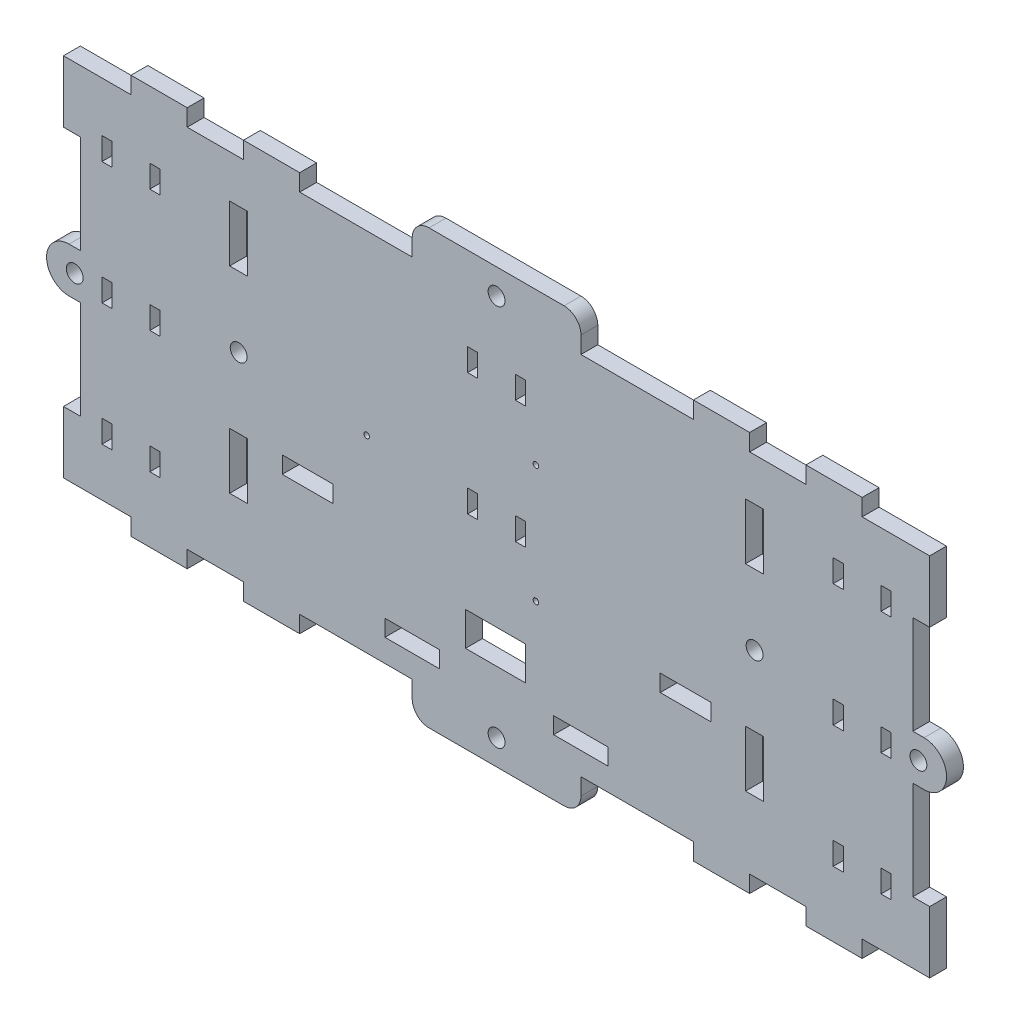
from build123d import *

# Parameters (mm, degrees)
CROQUIS2_R              = 0.5
CROQUIS2_R_2            = 1.5
CROQUIS2_W              = 1.8
CROQUIS2_H              = 4
CROQUIS2_W_2            = 9
CROQUIS2_H_2            = 3
CROQUIS2_W_3            = 9.7
CROQUIS2_H_3            = 2.94
CROQUIS2_W_4            = 10.628979849
CROQUIS2_H_4            = 6
SALIENTE_EXTRUIR1_DEPTH = 3


with BuildPart() as part:
    # Croquis2 → Saliente-Extruir1 (new body)
    with BuildSketch(Plane.XY):
        with BuildLine():
            Line((33708.140369107, 12866.76836421), (33708.140369107, 12884.268432106))
            Line((33708.140369107, 12884.268432106), (33710.140369103, 12884.268296333))
            ThreePointArc((33710.140369103, 12884.268296333), (33714.140640639, 12888.268024778), (33710.140912194, 12892.268296314))
            Line((33710.140912194, 12892.268296314), (33708.14091219, 12892.268296314))
            Line((33708.14091219, 12892.268296314), (33708.140369107, 12909.76836421))
            Line((33708.140369107, 12909.76836421), (33711.140369107, 12909.76836421))
            Line((33711.140369107, 12909.76836421), (33711.140369107, 12920.76836421))
            Line((33711.140369107, 12920.76836421), (33699.140369107, 12920.76836421))
            Line((33699.140369107, 12920.76836421), (33699.140369107, 12923.76836421))
            Line((33699.140369107, 12923.76836421), (33689.140369107, 12923.76836421))
            Line((33689.140369107, 12923.76836421), (33689.140369107, 12920.76836421))
            Line((33689.140369107, 12920.76836421), (33679.140369107, 12920.76836421))
            Line((33679.140369107, 12920.76836421), (33679.140369107, 12923.76836421))
            Line((33679.140369107, 12923.76836421), (33669.140369107, 12923.76836421))
            Line((33669.140369107, 12923.76836421), (33669.140369107, 12920.76836421))
            Line((33669.140369107, 12920.76836421), (33649.140369107, 12920.76836421))
            Line((33649.140369107, 12920.76836421), (33649.140369107, 12923.76836421))
            ThreePointArc((33649.140369107, 12923.76836421), (33648.261689451, 12925.889684554), (33646.140369107, 12926.76836421))
            Line((33646.140369107, 12926.76836421), (33622.140369107, 12926.76836421))
            ThreePointArc((33622.140369107, 12926.76836421), (33620.019048764, 12925.889684554), (33619.140369107, 12923.76836421))
            Line((33619.140369107, 12923.76836421), (33619.140369107, 12920.76836421))
            Line((33619.140369107, 12920.76836421), (33599.140369107, 12920.76836421))
            Line((33599.140369107, 12920.76836421), (33599.140369107, 12923.76836421))
            Line((33599.140369107, 12923.76836421), (33589.140369107, 12923.76836421))
            Line((33589.140369107, 12923.76836421), (33589.140369107, 12920.76836421))
            Line((33589.140369107, 12920.76836421), (33579.140369107, 12920.76836421))
            Line((33579.140369107, 12920.76836421), (33579.140369107, 12923.76836421))
            Line((33579.140369107, 12923.76836421), (33569.140369107, 12923.76836421))
            Line((33569.140369107, 12923.76836421), (33569.140369107, 12920.76836421))
            Line((33569.140369107, 12920.76836421), (33557.140369107, 12920.76836421))
            Line((33557.140369107, 12920.76836421), (33557.140369107, 12909.76836421))
            Line((33557.140369107, 12909.76836421), (33560.140369107, 12909.76836421))
            Line((33560.140369107, 12909.76836421), (33560.139826016, 12892.268432087))
            Line((33560.139826016, 12892.268432087), (33558.13982602, 12892.268296314))
            ThreePointArc((33558.13982602, 12892.268296314), (33554.140097575, 12888.268024778), (33558.140369112, 12884.268296333))
            Line((33558.140369112, 12884.268296333), (33560.140369107, 12884.268432106))
            Line((33560.140369107, 12884.268432106), (33560.140369107, 12866.76836421))
            Line((33560.140369107, 12866.76836421), (33559.115527824, 12866.76836421))
            Line((33559.115527824, 12866.76836421), (33558.815527824, 12866.76836421))
            Line((33558.815527824, 12866.76836421), (33557.140369107, 12866.76836421))
            Line((33557.140369107, 12866.76836421), (33557.140369107, 12861.352876793))
            Line((33557.140369107, 12861.352876793), (33557.140369107, 12861.058331403))
            Line((33557.140369107, 12861.058331403), (33557.140369107, 12855.76836421))
            Line((33557.140369107, 12855.76836421), (33569.140369107, 12855.76836421))
            Line((33569.140369107, 12855.76836421), (33569.140369107, 12852.76836421))
            Line((33569.140369107, 12852.76836421), (33579.140369107, 12852.76836421))
            Line((33579.140369107, 12852.76836421), (33579.140369107, 12855.76836421))
            Line((33579.140369107, 12855.76836421), (33589.140369107, 12855.76836421))
            Line((33589.140369107, 12855.76836421), (33589.140369107, 12852.76836421))
            Line((33589.140369107, 12852.76836421), (33599.140369107, 12852.76836421))
            Line((33599.140369107, 12852.76836421), (33599.140369107, 12855.76836421))
            Line((33599.140369107, 12855.76836421), (33609.140369107, 12855.76836421))
            Line((33609.140369107, 12855.76836421), (33619.140369107, 12855.76836421))
            Line((33619.140369107, 12855.76836421), (33619.140369107, 12852.76836421))
            ThreePointArc((33619.140369107, 12852.76836421), (33620.019048764, 12850.647043866), (33622.140369107, 12849.76836421))
            Line((33622.140369107, 12849.76836421), (33646.140369107, 12849.76836421))
            ThreePointArc((33646.140369107, 12849.76836421), (33648.261689451, 12850.647043866), (33649.140369107, 12852.76836421))
            Line((33649.140369107, 12852.76836421), (33649.140369107, 12855.76836421))
            Line((33649.140369107, 12855.76836421), (33659.140369107, 12855.76836421))
            Line((33659.140369107, 12855.76836421), (33665.009331237, 12855.76836421))
            Line((33665.009331237, 12855.76836421), (33665.309331237, 12855.76836421))
            Line((33665.309331237, 12855.76836421), (33669.140369107, 12855.76836421))
            Line((33669.140369107, 12855.76836421), (33669.140369107, 12852.76836421))
            Line((33669.140369107, 12852.76836421), (33679.140369107, 12852.76836421))
            Line((33679.140369107, 12852.76836421), (33679.140369107, 12855.76836421))
            Line((33679.140369107, 12855.76836421), (33685.009331237, 12855.76836421))
            Line((33685.009331237, 12855.76836421), (33685.309331237, 12855.76836421))
            Line((33685.309331237, 12855.76836421), (33689.140369107, 12855.76836421))
            Line((33689.140369107, 12855.76836421), (33689.140369107, 12852.76836421))
            Line((33689.140369107, 12852.76836421), (33699.140369107, 12852.76836421))
            Line((33699.140369107, 12852.76836421), (33699.140369107, 12855.76836421))
            Line((33699.140369107, 12855.76836421), (33711.140369107, 12855.76836421))
            Line((33711.140369107, 12855.76836421), (33711.140369107, 12866.76836421))
            Line((33711.140369107, 12866.76836421), (33708.140369107, 12866.76836421))
        make_face()
        with Locations((33641.140369107, 12899.76836421)):
            Circle(CROQUIS2_R, mode=Mode.SUBTRACT)
        with Locations((33641.140369107, 12878.76836421)):
            Circle(CROQUIS2_R, mode=Mode.SUBTRACT)
        with Locations((33680.011779321, 12890.673818632)):
            Circle(CROQUIS2_R_2, mode=Mode.SUBTRACT)
        with Locations((33588.287365241, 12890.673818632)):
            Circle(CROQUIS2_R_2, mode=Mode.SUBTRACT)
        with Locations((33611.040369107, 12889.26836421)):
            Circle(CROQUIS2_R, mode=Mode.SUBTRACT)
        with Locations((33709.140640651, 12888.26836421)):
            Circle(CROQUIS2_R_2, mode=Mode.SUBTRACT)
        with Locations((33559.140097564, 12888.26836421)):
            Circle(CROQUIS2_R_2, mode=Mode.SUBTRACT)
        with Locations((33634.140369107, 12922.26836421)):
            Circle(CROQUIS2_R_2, mode=Mode.SUBTRACT)
        with Locations((33634.140369107, 12854.26836421)):
            Circle(CROQUIS2_R_2, mode=Mode.SUBTRACT)
        Polygon((33589.787365241, 12868.173818632), (33586.787365241, 12868.173818632), (33586.687365241, 12868.173818632), (33586.687365241, 12878.173818632), (33586.787365241, 12878.173818632), (33589.787365241, 12878.173818632), (33589.887365241, 12878.173818632), (33589.887365241, 12868.173818632), align=None, mode=Mode.SUBTRACT)
        Polygon((33589.787365241, 12903.173818632), (33586.787365241, 12903.173818632), (33586.737365241, 12903.173818632), (33586.687365241, 12903.173818632), (33586.687365241, 12913.173818632), (33586.787365241, 12913.173818632), (33589.787365241, 12913.173818632), (33589.887365241, 12913.173818632), (33589.887365241, 12903.173818632), (33589.837365241, 12903.173818632), align=None, mode=Mode.SUBTRACT)
        Polygon((33681.493372973, 12868.173818632), (33678.493372973, 12868.173818632), (33678.393372973, 12868.173818632), (33678.393372973, 12878.173818632), (33678.493372973, 12878.173818632), (33681.493372973, 12878.173818632), (33681.593372973, 12878.173818632), (33681.593372973, 12868.173818632), align=None, mode=Mode.SUBTRACT)
        Polygon((33681.493372973, 12903.173818632), (33678.493372973, 12903.173818632), (33678.393372973, 12903.173818632), (33678.393372973, 12913.173818632), (33678.493372973, 12913.173818632), (33681.493372973, 12913.173818632), (33681.593372973, 12913.173818632), (33681.593372973, 12903.173818632), align=None, mode=Mode.SUBTRACT)
        with Locations((33564.890369107, 12909.90336421)):
            Rectangle(CROQUIS2_W, CROQUIS2_H, mode=Mode.SUBTRACT)
        with Locations((33573.390369107, 12909.90336421)):
            Rectangle(CROQUIS2_W, CROQUIS2_H, mode=Mode.SUBTRACT)
        with Locations((33564.890369107, 12888.14336421)):
            Rectangle(CROQUIS2_W, CROQUIS2_H, mode=Mode.SUBTRACT)
        with Locations((33573.390369107, 12888.14336421)):
            Rectangle(CROQUIS2_W, CROQUIS2_H, mode=Mode.SUBTRACT)
        with Locations((33564.890369107, 12866.38336421)):
            Rectangle(CROQUIS2_W, CROQUIS2_H, mode=Mode.SUBTRACT)
        with Locations((33573.390369107, 12866.38336421)):
            Rectangle(CROQUIS2_W, CROQUIS2_H, mode=Mode.SUBTRACT)
        with Locations((33600.540369107, 12877.26836421)):
            Rectangle(CROQUIS2_W_2, CROQUIS2_H_2, mode=Mode.SUBTRACT)
        with Locations((33619.140369107, 12861.26836421)):
            Rectangle(CROQUIS2_W_3, CROQUIS2_H_3, mode=Mode.SUBTRACT)
        with Locations((33633.931190824, 12868.26836421)):
            Rectangle(CROQUIS2_W_4, CROQUIS2_H_4, mode=Mode.SUBTRACT)
        with Locations((33629.890369107, 12888.14336421)):
            Rectangle(CROQUIS2_W, CROQUIS2_H, mode=Mode.SUBTRACT)
        with Locations((33638.390369107, 12888.14336421)):
            Rectangle(CROQUIS2_W, CROQUIS2_H, mode=Mode.SUBTRACT)
        with Locations((33638.390369107, 12909.90336421)):
            Rectangle(CROQUIS2_W, CROQUIS2_H, mode=Mode.SUBTRACT)
        with Locations((33629.890369107, 12909.90336421)):
            Rectangle(CROQUIS2_W, CROQUIS2_H, mode=Mode.SUBTRACT)
        with Locations((33649.140369107, 12861.26836421)):
            Rectangle(CROQUIS2_W_3, CROQUIS2_H_3, mode=Mode.SUBTRACT)
        with Locations((33667.740369107, 12877.26836421)):
            Rectangle(CROQUIS2_W_2, CROQUIS2_H_2, mode=Mode.SUBTRACT)
        with Locations((33694.890369107, 12909.90336421)):
            Rectangle(CROQUIS2_W, CROQUIS2_H, mode=Mode.SUBTRACT)
        with Locations((33703.390369107, 12909.90336421)):
            Rectangle(CROQUIS2_W, CROQUIS2_H, mode=Mode.SUBTRACT)
        with Locations((33694.890369107, 12888.14336421)):
            Rectangle(CROQUIS2_W, CROQUIS2_H, mode=Mode.SUBTRACT)
        with Locations((33703.390369107, 12888.14336421)):
            Rectangle(CROQUIS2_W, CROQUIS2_H, mode=Mode.SUBTRACT)
        with Locations((33694.890369107, 12866.38336421)):
            Rectangle(CROQUIS2_W, CROQUIS2_H, mode=Mode.SUBTRACT)
        with Locations((33703.390369107, 12866.38336421)):
            Rectangle(CROQUIS2_W, CROQUIS2_H, mode=Mode.SUBTRACT)
    extrude(amount=SALIENTE_EXTRUIR1_DEPTH)


solid = part.part
